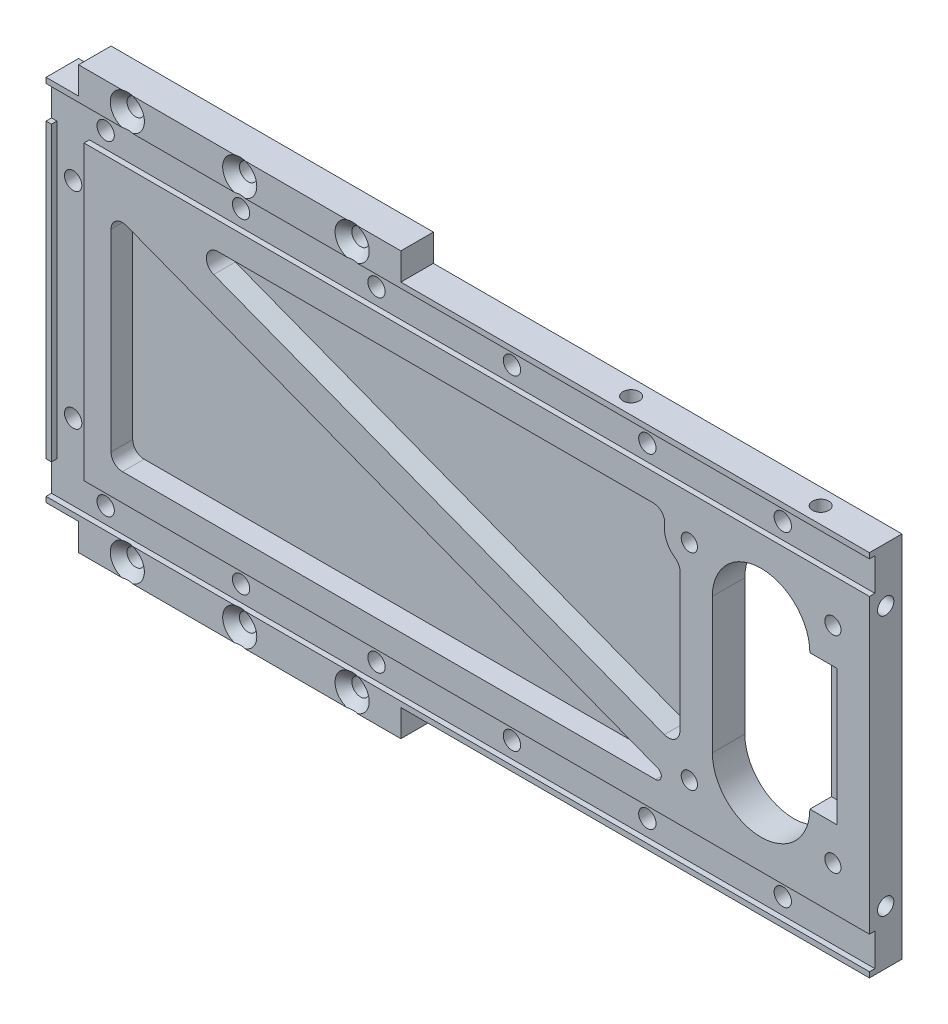
from build123d import *

# Parameters (mm, degrees)
SKETCH_1_W                     = 152
SKETCH_1_H                     = 68
EXTRUDE_1_DEPTH                = 3
EXTRUDE_2_REACH                = 85.313
SKETCH_1_5_W                   = 59.5
SKETCH_1_5_H                   = 5
EXTRUDE_2_DIRECTION_2_REACH    = 85.313
CUT_EXTRUDE_START              = 2
CUT_EXTRUDE_1_DEPTH            = 1
CUT_EXTRUDE_2_DEPTH            = 86.475142585
CUT_EXTRUDE_2_DEPTH_BACK       = 86.475142585
CUT_EXTRUDE_3_DEPTH            = 86.475142585
CUT_EXTRUDE_3_DEPTH_BACK       = 1
SKETCH_1_8_W                   = 5
SKETCH_1_8_H                   = 25
HOLE_WIZARD_M3_3_D             = 3.2
HOLE_WIZARD_M3_3_CSINK_D       = 6.3
HOLE_WIZARD_M3_3_CSINK_ANGLE   = 90
PATTERN_LINEAR_1_COUNT         = 6
PATTERN_LINEAR_1_PITCH         = 25
HOLE_WIZARD_M3_2_D             = 3.2
HOLE_WIZARD_M3_2_CSINK_D       = 6.3
HOLE_WIZARD_M3_2_CSINK_ANGLE   = 90
HOLE_WIZARD_M3_1_D             = 3.2
HOLE_WIZARD_M3_1_DEPTH         = 6
HOLE_WIZARD_M3_1_CSINK_D       = 6.3
HOLE_WIZARD_M3_1_CSINK_ANGLE   = 90
HOLE_WIZARD_M3_1_TIP           = 0.96137699
M3X0_5_3_D                     = 2.5
M3X0_5_3_DEPTH                 = 8.5
M3X0_5_3_CBORE_D               = 3
M3X0_5_3_CBORE_DEPTH           = 6
M3X0_5_3_TIP                   = 0.751075774
M3X0_5_4_D                     = 3
M3X0_5_5_D                     = 2.5
M3X0_5_5_DEPTH                 = 8.5
M3X0_5_5_CBORE_D               = 3
M3X0_5_5_CBORE_DEPTH           = 6
M3X0_5_5_TIP                   = 0.751075774
M3X0_5_5_ON_FACE_2_D           = 2.5
M3X0_5_5_ON_FACE_2_DEPTH       = 8.5
M3X0_5_5_ON_FACE_2_CBORE_D     = 3
M3X0_5_5_ON_FACE_2_CBORE_DEPTH = 6
M3X0_5_5_ON_FACE_2_TIP         = 0.751075774
M3X0_5_2_D                     = 2.5
M3X0_5_2_DEPTH                 = 8.5
M3X0_5_2_CBORE_D               = 3
M3X0_5_2_CBORE_DEPTH           = 6
M3X0_5_2_TIP                   = 0.751075774
M3X0_5_2_ON_FACE_2_D           = 2.5
M3X0_5_2_ON_FACE_2_DEPTH       = 8.5
M3X0_5_2_ON_FACE_2_CBORE_D     = 3
M3X0_5_2_ON_FACE_2_CBORE_DEPTH = 6
M3X0_5_2_ON_FACE_2_TIP         = 0.751075774
CUT_EXTRUDE_6_DEPTH            = 4
FILLET_3_R                     = 2.1


with BuildPart() as part:
    # ｽｹｯﾁ1 → ﾎﾞｽ - 押し出し1 (new, symmetric)
    with BuildSketch(Plane.XY):
        Rectangle(SKETCH_1_W, SKETCH_1_H)
    extrude(amount=EXTRUDE_1_DEPTH, both=True)

    # ﾎﾞｽ - 押し出し2: up to this face of the body (flat: up to its plane)
    extrude_2_end = Plane(part.part.faces().sort_by_distance((0, 0, 3))[0])
    # ｽｹｯﾁ1<5> → ﾎﾞｽ - 押し出し2 (add, up to the picked face)
    with BuildSketch(Plane.XY, mode=Mode.PRIVATE) as extrude_2_sk1:
        with Locations((-40.25, 36.5)):
            Rectangle(SKETCH_1_5_W, SKETCH_1_5_H)
    extrude_2_tool1 = split(extrude(extrude_2_sk1.sketch, amount=EXTRUDE_2_REACH, mode=Mode.PRIVATE), bisect_by=extrude_2_end, keep=Keep.BOTH, mode=Mode.PRIVATE)
    # ｽｹｯﾁ1<5> → ﾎﾞｽ - 押し出し2 (add, up to the picked face)
    with BuildSketch(Plane.XY, mode=Mode.PRIVATE) as extrude_2_sk2:
        with Locations((-40.25, -36.5)):
            Rectangle(SKETCH_1_5_W, SKETCH_1_5_H)
    extrude_2_tool2 = split(extrude(extrude_2_sk2.sketch, amount=EXTRUDE_2_REACH, mode=Mode.PRIVATE), bisect_by=extrude_2_end, keep=Keep.BOTH, mode=Mode.PRIVATE)
    add(extrude_2_tool1.solids().sort_by(Axis((-40.25, 36.5, 0), (0, 0, 1)))[0])
    add(extrude_2_tool2.solids().sort_by(Axis((-40.25, -36.5, 0), (0, 0, 1)))[0])

    # ﾎﾞｽ - 押し出し2 direction 2: up to this face of the body (flat: up to its plane)
    extrude_2_direction_2_end = Plane(part.part.faces().sort_by_distance((0, 0, -3))[0])
    # ｽｹｯﾁ1<5> → ﾎﾞｽ - 押し出し2 direction 2 (add, up to the picked face)
    with BuildSketch(Plane.XY, mode=Mode.PRIVATE) as extrude_2_direction_2_sk1:
        with Locations((-40.25, 36.5)):
            Rectangle(SKETCH_1_5_W, SKETCH_1_5_H)
    extrude_2_direction_2_tool1 = split(extrude(extrude_2_direction_2_sk1.sketch, amount=-EXTRUDE_2_DIRECTION_2_REACH, mode=Mode.PRIVATE), bisect_by=extrude_2_direction_2_end, keep=Keep.BOTH, mode=Mode.PRIVATE)
    # ｽｹｯﾁ1<5> → ﾎﾞｽ - 押し出し2 direction 2 (add, up to the picked face)
    with BuildSketch(Plane.XY, mode=Mode.PRIVATE) as extrude_2_direction_2_sk2:
        with Locations((-40.25, -36.5)):
            Rectangle(SKETCH_1_5_W, SKETCH_1_5_H)
    extrude_2_direction_2_tool2 = split(extrude(extrude_2_direction_2_sk2.sketch, amount=-EXTRUDE_2_DIRECTION_2_REACH, mode=Mode.PRIVATE), bisect_by=extrude_2_direction_2_end, keep=Keep.BOTH, mode=Mode.PRIVATE)
    add(extrude_2_direction_2_tool1.solids().sort_by(Axis((-40.25, 36.5, 0), (0, 0, -1)))[0])
    add(extrude_2_direction_2_tool2.solids().sort_by(Axis((-40.25, -36.5, 0), (0, 0, -1)))[0])

    # ｽｹｯﾁ1<3> → ｶｯﾄ - 押し出し1 (cut)
    with BuildSketch(Plane.XY.offset(CUT_EXTRUDE_START)):
        Polygon((76, 33), (-76, 33), (-76, 27), (-75, 27), (-75, -27), (-76, -27), (-76, -33), (76, -33), (76, -27), (-69, -27), (-69, 27), (76, 27), align=None)
    extrude(amount=CUT_EXTRUDE_1_DEPTH, mode=Mode.SUBTRACT)

    # ｽｹｯﾁ1<7> → ｶｯﾄ - 押し出し2 (cut, two sides: drawn at the far end of the back side and taken through both)
    with BuildSketch(Plane.XY.offset(-CUT_EXTRUDE_2_DEPTH_BACK)):
        with BuildLine():
            Line((47, 12.5), (47, -12.5))
            ThreePointArc((47, -12.5), (56, -21.5), (65, -12.5))
            Line((65, -12.5), (65, 12.5))
            ThreePointArc((65, 12.5), (56, 21.5), (47, 12.5))
        make_face()
    extrude(amount=CUT_EXTRUDE_2_DEPTH + CUT_EXTRUDE_2_DEPTH_BACK, mode=Mode.SUBTRACT)

    # ｽｹｯﾁ1<8> → ｶｯﾄ - 押し出し3 (cut, two sides: drawn at the far end of the back side and taken through both)
    with BuildSketch(Plane.XY.offset(-CUT_EXTRUDE_3_DEPTH_BACK)):
        with Locations((67.5, 0)):
            Rectangle(SKETCH_1_8_W, SKETCH_1_8_H)
    extrude(amount=CUT_EXTRUDE_3_DEPTH + CUT_EXTRUDE_3_DEPTH_BACK, mode=Mode.SUBTRACT)

    # M3 丸皿ねじ用皿穴3 (through all)
    with Locations(Plane(origin=(-66, 30, -3), x_dir=(-1, 0, 0), z_dir=(0, 0, -1))):
        with Locations((0, 0), (0, -60)):
            hole_wizard_m3_3 = CounterSinkHole(HOLE_WIZARD_M3_3_D / 2, HOLE_WIZARD_M3_3_CSINK_D / 2, counter_sink_angle=HOLE_WIZARD_M3_3_CSINK_ANGLE)

    # 直線ﾊﾟﾀｰﾝ1: M3 丸皿ねじ用皿穴3 ×6
    with Locations(*[(i * PATTERN_LINEAR_1_PITCH, 0, 0) for i in range(1, PATTERN_LINEAR_1_COUNT)]):
        add(hole_wizard_m3_3, mode=Mode.SUBTRACT)

    # M3 丸皿ねじ用皿穴2 (through all)
    with Locations(Plane(origin=(-61, 36, 3), x_dir=(1, 0, 0), z_dir=(0, 0, 1))):
        with Locations((0, 0), (20.75, 0), (41.5, 0), (0, -72), (20.75, -72), (41.5, -72)):
            CounterSinkHole(HOLE_WIZARD_M3_2_D / 2, HOLE_WIZARD_M3_2_CSINK_D / 2, counter_sink_angle=HOLE_WIZARD_M3_2_CSINK_ANGLE)

    # M3 丸皿ねじ用皿穴1
    with Locations(Plane(origin=(-72, 19, -3), x_dir=(-1, 0, 0), z_dir=(0, 0, -1))):
        with Locations((0, 0), (0, -38)):
            CounterSinkHole(HOLE_WIZARD_M3_1_D / 2, HOLE_WIZARD_M3_1_CSINK_D / 2, depth=HOLE_WIZARD_M3_1_DEPTH, counter_sink_angle=HOLE_WIZARD_M3_1_CSINK_ANGLE)
            with Locations((0, 0, -(HOLE_WIZARD_M3_1_DEPTH + HOLE_WIZARD_M3_1_TIP / 2))):  # 118° drill point
                Cone(0, HOLE_WIZARD_M3_1_D / 2, HOLE_WIZARD_M3_1_TIP, mode=Mode.SUBTRACT)

    # M3x0.5 ねじ穴3
    with Locations(Plane(origin=(76, 24, 0), x_dir=(0, 0, 1), z_dir=(1, 0, 0))):
        with Locations((0, 0), (0, 48)):
            CounterBoreHole(M3X0_5_3_D / 2, M3X0_5_3_CBORE_D / 2, M3X0_5_3_CBORE_DEPTH, depth=M3X0_5_3_DEPTH)
            with Locations((0, 0, -(M3X0_5_3_DEPTH + M3X0_5_3_TIP / 2))):  # 118° drill point
                Cone(0, M3X0_5_3_D / 2, M3X0_5_3_TIP, mode=Mode.SUBTRACT)

    # M3x0.5 ねじ穴4 (through all)
    with Locations(Plane(origin=(42.75, 19, 3), x_dir=(1, 0, 0), z_dir=(0, 0, 1))):
        with Locations((0, 0), (26.5, 0), (26.5, -38), (0, -38)):
            Hole(M3X0_5_4_D / 2)

    # M3x0.5 ねじ穴5
    with Locations(Plane(origin=(29, -34, 0), x_dir=(-1, 0, 0), z_dir=(0, -1, 0))):
        with Locations((0, 0), (-35, 0)):
            CounterBoreHole(M3X0_5_5_D / 2, M3X0_5_5_CBORE_D / 2, M3X0_5_5_CBORE_DEPTH, depth=M3X0_5_5_DEPTH)
            with Locations((0, 0, -(M3X0_5_5_DEPTH + M3X0_5_5_TIP / 2))):  # 118° drill point
                Cone(0, M3X0_5_5_D / 2, M3X0_5_5_TIP, mode=Mode.SUBTRACT)

    # M3x0.5 ねじ穴5 on face 2
    with Locations(Plane(origin=(-76, -12, 0), x_dir=(0, 0, -1), z_dir=(-1, 0, 0))):
        with Locations((0, 0)):
            CounterBoreHole(M3X0_5_5_ON_FACE_2_D / 2, M3X0_5_5_ON_FACE_2_CBORE_D / 2, M3X0_5_5_ON_FACE_2_CBORE_DEPTH, depth=M3X0_5_5_ON_FACE_2_DEPTH)
            with Locations((0, 0, -(M3X0_5_5_ON_FACE_2_DEPTH + M3X0_5_5_ON_FACE_2_TIP / 2))):  # 118° drill point
                Cone(0, M3X0_5_5_ON_FACE_2_D / 2, M3X0_5_5_ON_FACE_2_TIP, mode=Mode.SUBTRACT)

    # M3x0.5 ねじ穴2
    with Locations(Plane(origin=(29, 34, 0), x_dir=(1, 0, 0), z_dir=(0, 1, 0))):
        with Locations((0, 0), (35, 0)):
            CounterBoreHole(M3X0_5_2_D / 2, M3X0_5_2_CBORE_D / 2, M3X0_5_2_CBORE_DEPTH, depth=M3X0_5_2_DEPTH)
            with Locations((0, 0, -(M3X0_5_2_DEPTH + M3X0_5_2_TIP / 2))):  # 118° drill point
                Cone(0, M3X0_5_2_D / 2, M3X0_5_2_TIP, mode=Mode.SUBTRACT)

    # M3x0.5 ねじ穴2 on face 2
    with Locations(Plane(origin=(-76, 12, 0), x_dir=(0, 0, -1), z_dir=(-1, 0, 0))):
        with Locations((0, 0)):
            CounterBoreHole(M3X0_5_2_ON_FACE_2_D / 2, M3X0_5_2_ON_FACE_2_CBORE_D / 2, M3X0_5_2_ON_FACE_2_CBORE_DEPTH, depth=M3X0_5_2_ON_FACE_2_DEPTH)
            with Locations((0, 0, -(M3X0_5_2_ON_FACE_2_DEPTH + M3X0_5_2_ON_FACE_2_TIP / 2))):  # 118° drill point
                Cone(0, M3X0_5_2_ON_FACE_2_D / 2, M3X0_5_2_ON_FACE_2_TIP, mode=Mode.SUBTRACT)

    # ｽｹｯﾁ13 → ｶｯﾄ - 押し出し6 (cut)
    with BuildSketch(Plane.XY.offset(3)):
        with BuildLine():
            Line((39.260891816, 22), (-55.632722069, 22))
            Line((-55.632722069, 22), (41.246638608, -15.20893478))
            ThreePointArc((41.246638608, -15.20893478), (41.061786906, -13.86006969), (41, -12.5))
            Line((41, -12.5), (41, 12.5))
            ThreePointArc((41, 12.5), (41.039944473, 13.593955494), (41.15956515, 14.682084657))
            ThreePointArc((41.15956515, 14.682084657), (38.295966929, 17.844376653), (39.260891816, 22))
        make_face()
        with BuildLine():
            Line((-64, 18.786338219), (-64, -22))
            Line((-64, -22), (36.531308939, -22))
            ThreePointArc((36.531308939, -22), (37.563709002, -21.141442184), (36.907775459, -19.969809733))
            Line((36.907775459, -19.969809733), (-64, 18.786338219))
        make_face()
    extrude(amount=-CUT_EXTRUDE_6_DEPTH, mode=Mode.SUBTRACT)

    # ﾌｨﾚｯﾄ3
    fillet_3_edges = [part.edges().sort_by_distance(p)[0] for p in [
        (-64, -22, 1),
        (-64, 18.786338219, 1),
        (39.260891816, 22, 1),
        (-55.632722069, 22, 1),
        (41.15956515, 14.682084657, 1),
        (41.246638608, -15.20893478, 1),
    ]]
    fillet(fillet_3_edges, radius=FILLET_3_R)


solid = part.part
